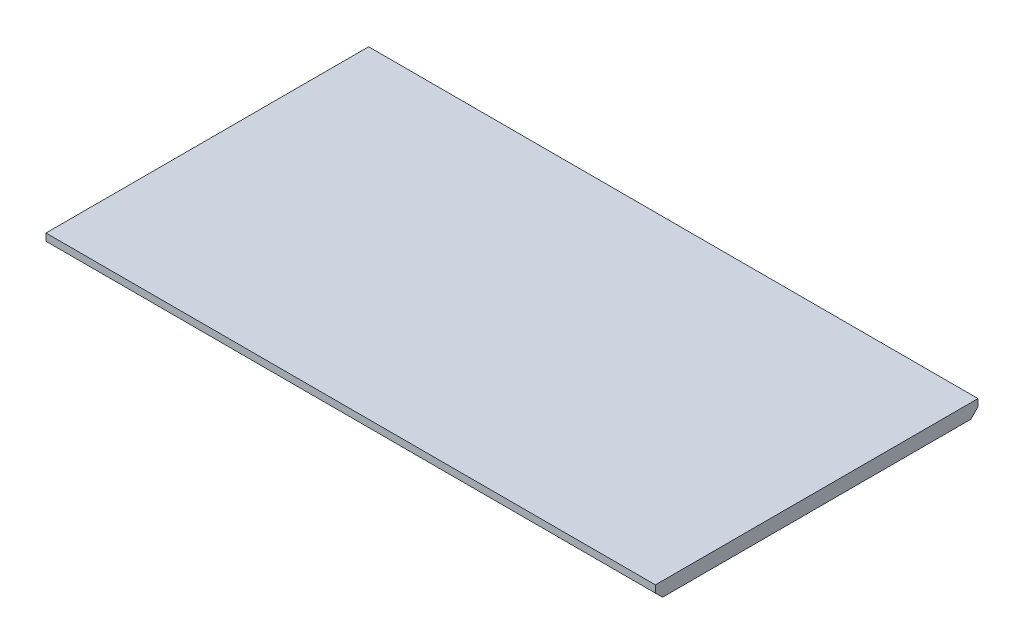
from build123d import *

# Parameters (mm, degrees)
SKETCH_1_W      = 85
SKETCH_1_H      = 45
EXTRUDE_1_DEPTH = 2
CHAMFER_1_SIZE  = 1


with BuildPart() as part:
    # 草图1 → 凸台-拉伸1 (new body)
    with BuildSketch(Plane(origin=(0, 0, 0), x_dir=(1, 0, 0), z_dir=(0, 1, 0))):
        Rectangle(SKETCH_1_W, SKETCH_1_H)
    extrude(amount=EXTRUDE_1_DEPTH)

    # 倒角1
    chamfer_1_edges = [part.edges().sort_by_distance(p)[0] for p in [
        (0, 0, 22.5),
        (0, 0, -22.5),
    ]]
    chamfer(chamfer_1_edges, length=CHAMFER_1_SIZE)


solid = part.part
